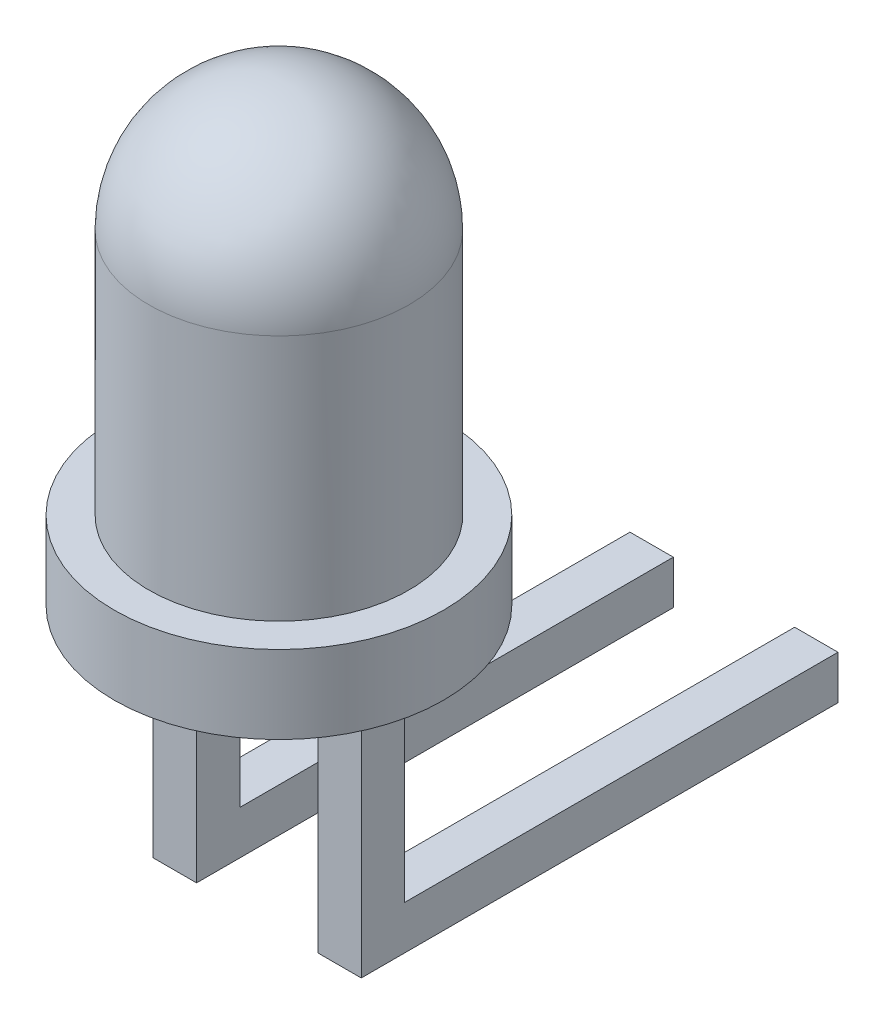
from build123d import *

# Parameters (mm, degrees)
SKICA2_W                = 0.5
SKICA2_H                = 3
P_IDAT_VYSUNUT_M1_DEPTH = 0.25
SKICA3_W                = 0.5
SKICA3_H                = 0.504797781
P_IDAT_VYSUNUT_M2_DEPTH = 5


with BuildPart() as part:
    # Skica1 → Rotovat1 (revolve)
    with BuildSketch(Plane.XY):
        with BuildLine():
            Line((-1.5, 6.066522781), (-1.5, 3.216522781))
            Line((-1.5, 3.216522781), (-1.9, 3.216522781))
            Line((-1.9, 3.216522781), (-1.9, 2.316522781))
            Line((-1.9, 2.316522781), (0, 2.316522781))
            Line((0, 2.316522781), (0, 7.566522781))
            ThreePointArc((0, 7.566522781), (-1.060660172, 7.127182953), (-1.5, 6.066522781))
        make_face()
    revolve(axis=Axis((0, 7.566522781, 0), (0, -1, 0)))

    # Skica2 → Přidat vysunutím1 (add, symmetric)
    with BuildSketch(Plane.XY):
        with Locations((0.95, 0.816522781)):
            Rectangle(SKICA2_W, SKICA2_H)
        with Locations((-0.95, 0.816522781)):
            Rectangle(SKICA2_W, SKICA2_H)
    extrude(amount=P_IDAT_VYSUNUT_M1_DEPTH, both=True)

    # Skica3 → Přidat vysunutím2 (add)
    with BuildSketch(Plane(origin=(0, 0, -0.25), x_dir=(-1, 0, 0), z_dir=(0, 0, -1))):
        with Locations((0.95, -0.431078329)):
            Rectangle(SKICA3_W, SKICA3_H)
        with Locations((-0.95, -0.431078329)):
            Rectangle(SKICA3_W, SKICA3_H)
    extrude(amount=P_IDAT_VYSUNUT_M2_DEPTH)


solid = part.part
